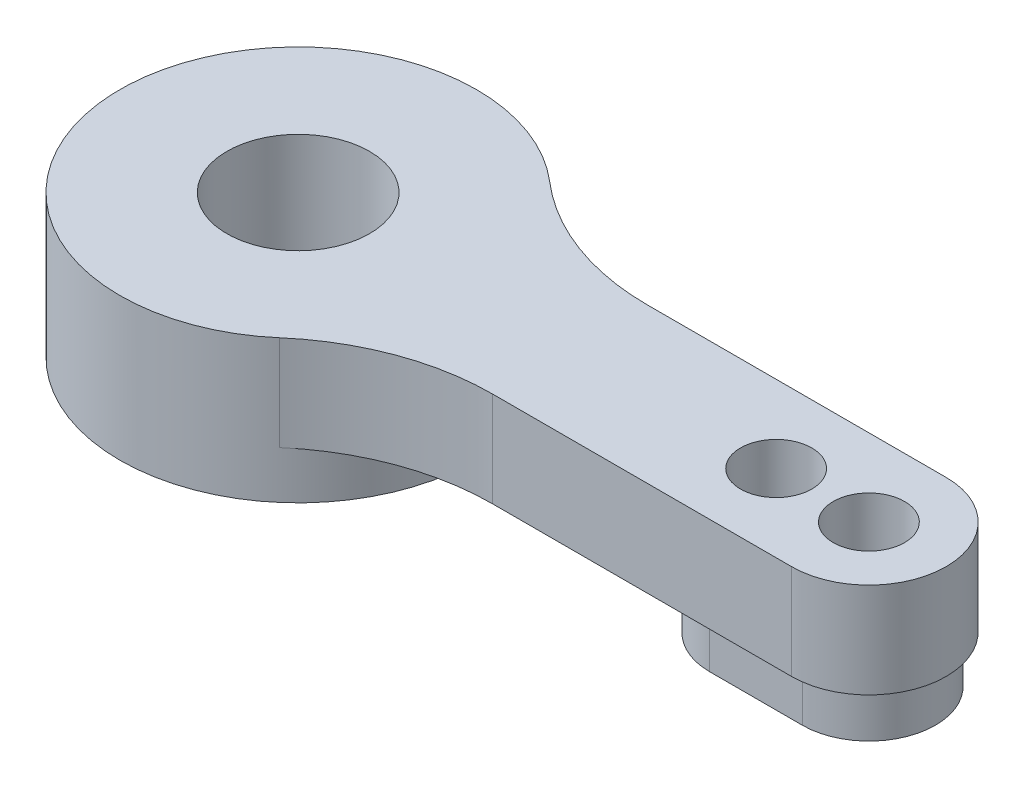
from build123d import *

# Parameters (mm, degrees)
SKETCH1_R               = 7.5
BOSS_EXTRUDE1_DEPTH     = 6
BOSS_EXTRUDE2_DEPTH     = 4
BOSS_EXTRUDE3_DEPTH     = 2
CUT_EXTRUDE1_DEPTH      = 29.893122019
CUT_EXTRUDE1_DEPTH_BACK = 29.893122019
SKETCH5_R               = 1.5
SKETCH5_R_2             = 3
FILLET1_R               = 10


with BuildPart() as part:
    # Sketch1 → Boss-Extrude1 (new body)
    with BuildSketch(Plane(origin=(0, 0, 0), x_dir=(1, 0, 0), z_dir=(0, 1, 0))):
        with Locations(Location((0, 0, 0), (0, 0, 270))):
            Circle(SKETCH1_R)
    extrude(amount=BOSS_EXTRUDE1_DEPTH)

    # Sketch2 → Boss-Extrude2 (add)
    with BuildSketch(Plane(origin=(0, 6, 0), x_dir=(1, 0, 0), z_dir=(0, 1, 0))):
        with BuildLine():
            Line((0, 3.25), (24, 3.25))
            ThreePointArc((24, 3.25), (27.25, 0), (24, -3.25))
            Line((24, -3.25), (0, -3.25))
            ThreePointArc((0, -3.25), (-3.25, 0), (0, 3.25))
        make_face()
    extrude(amount=-BOSS_EXTRUDE2_DEPTH)

    # Sketch4 → Boss-Extrude3 (add)
    with BuildSketch(Plane(origin=(0, 2, 0), x_dir=(-1, 0, 0), z_dir=(0, -1, 0))):
        with BuildLine():
            Line((-24, 2.8), (-20.1, 2.8))
            ThreePointArc((-20.1, 2.8), (-17.3, 0), (-20.1, -2.8))
            Line((-20.1, -2.8), (-24, -2.8))
            ThreePointArc((-24, -2.8), (-26.8, 0), (-24, 2.8))
        make_face()
    extrude(amount=BOSS_EXTRUDE3_DEPTH)

    # Sketch5 → Cut-Extrude1 (cut, two sides: drawn at the far end of the back side and taken through both)
    with BuildSketch(Plane.XZ.offset(-CUT_EXTRUDE1_DEPTH_BACK)):
        with Locations(Location((24, 0, 0), (0, 0, 270))):
            Circle(SKETCH5_R)
        with Locations(Location((20.1, 0, 0), (0, 0, 270))):
            Circle(SKETCH5_R)
        with Locations(Location((0, 0, 0), (0, 0, 270))):
            Circle(SKETCH5_R_2)
    extrude(amount=CUT_EXTRUDE1_DEPTH + CUT_EXTRUDE1_DEPTH_BACK, mode=Mode.SUBTRACT)

    # Fillet1
    fillet1_edges = [part.edges().sort_by_distance(p)[0] for p in [
        (6.759252917, 4, -3.25),
        (6.759252917, 4, 3.25),
    ]]
    fillet(fillet1_edges, radius=FILLET1_R)


solid = part.part
